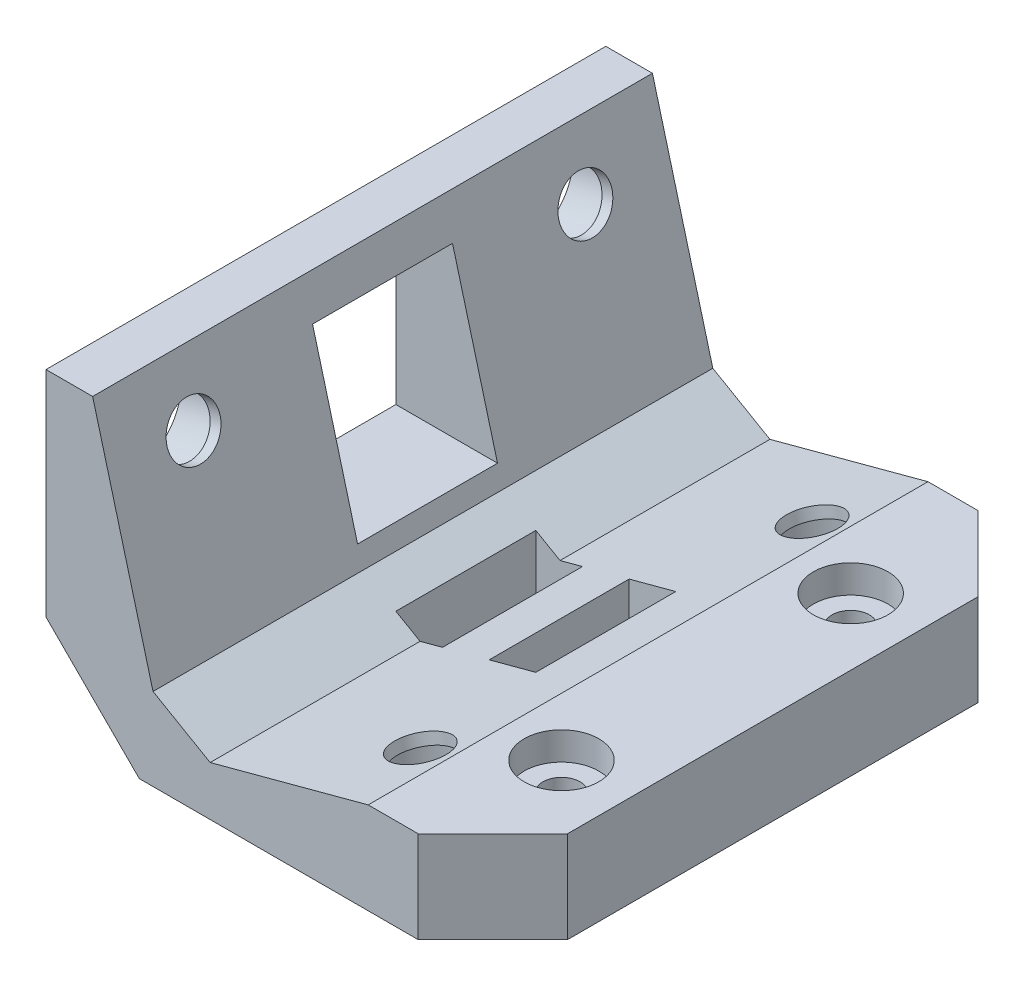
from build123d import *

# Parameters (mm, degrees)
BOSS_EXTRU_1_DEPTH       = 60
ESQUISSE2_R              = 2.85
ENL_V_MAT_EXTRU_1_DEPTH  = 30
ESQUISSE3_R              = 2.85
ENL_V_MAT_EXTRU_2_DEPTH  = 1.2
ENL_V_START              = -1.2
ESQUISSE4_R              = 5.5
ENL_V_MAT_EXTRU_3_DEPTH  = 30
CHANFREIN1_SIZE          = 5
CHANFREIN3_SIZE          = 10
ENL_V_MAT_EXTRU_5_REACH  = 83.872
ESQUISSE7_R              = 5.5
CHANFREIN4_SIZE          = 2
CHANFREIN4_SIZE2         = 7.464101615
BOSS_EXTRU_3_DEPTH       = 60
ESQUISSE10_R             = 2
ENL_V_MAT_EXTRU_7_DEPTH  = 60
ESQUISSE11_R             = 4
ENL_V_MAT_EXTRU_8_DEPTH  = 3
CHANFREIN5_SIZE          = 8
ESQUISSE12_W             = 5
ESQUISSE12_H             = 15
ENL_V_MAT_EXTRU_9_DEPTH  = 84.554960758
ESQUISSE13_W             = 15
ESQUISSE13_H             = 18
ENL_V_MAT_EXTRU_10_DEPTH = 84.554960758


with BuildPart() as part:
    # Esquisse1 → Boss.-Extru.1 (new body)
    with BuildSketch(Plane.XY):
        Polygon((0, 0), (44.894653535, 0), (41.742346142, 11.764571353), (12.764571353, 4), (5, 32.977774789), (0, 32.977774789), align=None)
    extrude(amount=BOSS_EXTRU_1_DEPTH)

    # Esquisse2 → Enlèv. mat.-Extru.1 (cut)
    with BuildSketch(Plane(origin=(12.909507207, 3.459092031, 0), x_dir=(0, 0, -1), z_dir=(0.965925826289071, 0.258819045102511, 0))):
        with Locations(Location((-51, 23.559989136, 0), (0, 0, 90))):
            Circle(ESQUISSE2_R)
        with Locations(Location((-9, 23.559989136, 0), (0, 0, 90))):
            Circle(ESQUISSE2_R)
    extrude(amount=-ENL_V_MAT_EXTRU_1_DEPTH, mode=Mode.SUBTRACT)

    # Esquisse3 → Enlèv. mat.-Extru.2 (cut)
    with BuildSketch(Plane(origin=(-0.144935854, 0.540907969, 0), x_dir=(0.96592582628907, 0.2588190451025147, 0), z_dir=(-0.25881904510251463, 0.9659258262890699, 0))):
        with Locations(Location((32.364905312, -9, 0), (0, 0, 180))):
            Circle(ESQUISSE3_R)
        with Locations(Location((32.364905312, -51, 0), (0, 0, 180))):
            Circle(ESQUISSE3_R)
    extrude(amount=-ENL_V_MAT_EXTRU_2_DEPTH, mode=Mode.SUBTRACT)

    # Esquisse4 → Enlèv. mat.-Extru.3 (cut)
    with BuildSketch(Plane(origin=(12.909507207, 3.459092031, 0), x_dir=(0, 0, -1), z_dir=(0.965925826289071, 0.258819045102511, 0)).offset(ENL_V_START)):
        with Locations(Location((-51, 23.559989136, 0), (0, 0, 90))):
            Circle(ESQUISSE4_R)
        with Locations(Location((-9, 23.559989136, 0), (0, 0, 90))):
            Circle(ESQUISSE4_R)
    extrude(amount=-ENL_V_MAT_EXTRU_3_DEPTH, mode=Mode.SUBTRACT)

    # Chanfrein1
    chanfrein1_edges = [part.edges().sort_by_distance(p)[0] for p in [
        (12.764571353, 4, 30),
    ]]
    chamfer(chanfrein1_edges, length=CHANFREIN1_SIZE)

    # Chanfrein3
    chanfrein3_edges = [part.edges().sort_by_distance(p)[0] for p in [
        (0, 0, 30),
    ]]
    chamfer(chanfrein3_edges, length=CHANFREIN3_SIZE)

    # Enlèv. mat.-Extru.5: up to this plane
    enl_v_mat_extru_5_end = Plane(origin=(31.427744907, 7.758450865, 51), z_dir=(-0.2588190451025147, 0.96592582628907, 0))
    # Esquisse7 → Enlèv. mat.-Extru.5 (cut, up to the surface)
    with BuildSketch(Plane.XZ, mode=Mode.PRIVATE) as enl_v_mat_extru_5_sk1:
        with Locations((31.117162053, 51)):
            Circle(ESQUISSE7_R)
    enl_v_mat_extru_5_tool1 = split(extrude(enl_v_mat_extru_5_sk1.sketch, amount=-ENL_V_MAT_EXTRU_5_REACH, mode=Mode.PRIVATE), bisect_by=enl_v_mat_extru_5_end, keep=Keep.BOTH, mode=Mode.PRIVATE)
    add(enl_v_mat_extru_5_tool1.solids().sort_by_distance((31.117162, 0, 51))[0], mode=Mode.SUBTRACT)
    # Esquisse7 → Enlèv. mat.-Extru.5 (cut, up to the surface)
    with BuildSketch(Plane.XZ, mode=Mode.PRIVATE) as enl_v_mat_extru_5_sk2:
        with Locations((31.117162053, 9)):
            Circle(ESQUISSE7_R)
    enl_v_mat_extru_5_tool2 = split(extrude(enl_v_mat_extru_5_sk2.sketch, amount=-ENL_V_MAT_EXTRU_5_REACH, mode=Mode.PRIVATE), bisect_by=enl_v_mat_extru_5_end, keep=Keep.BOTH, mode=Mode.PRIVATE)
    add(enl_v_mat_extru_5_tool2.solids().sort_by_distance((31.117162, 0, 9))[0], mode=Mode.SUBTRACT)

    # Chanfrein4
    chanfrein4_edges = [part.edges().sort_by_distance(p)[0] for p in [
        (41.742346142, 11.764571353, 30),
    ]]
    chanfrein4_side = [part.faces().sort_by_distance(p)[0] for p in [
        (43.318499838, 5.882285677, 30),
    ]]
    chamfer(chanfrein4_edges, length=CHANFREIN4_SIZE, length2=CHANFREIN4_SIZE2, reference=chanfrein4_side[0])

    # Esquisse8 → Boss.-Extru.3 (add)
    with BuildSketch(Plane.XY.offset(60)):
        Polygon((42.259984232, 9.8327197), (47.894653535, 9.8327197), (47.894653535, 0), (44.894653535, 0), align=None)
    extrude(amount=-BOSS_EXTRU_3_DEPTH)

    # Esquisse10 → Enlèv. mat.-Extru.7 (cut)
    with BuildSketch(Plane(origin=(0, 9.8327197, 0), x_dir=(1, 0, 0), z_dir=(0, 1, 0))):
        with Locations(Location((40.75, -14.5, 0), (0, 0, 180))):
            Circle(ESQUISSE10_R)
        with Locations(Location((40.75, -45.5, 0), (0, 0, 180))):
            Circle(ESQUISSE10_R)
    extrude(amount=-ENL_V_MAT_EXTRU_7_DEPTH, mode=Mode.SUBTRACT)

    # Esquisse11 → Enlèv. mat.-Extru.8 (cut)
    with BuildSketch(Plane(origin=(0, 9.8327197, 0), x_dir=(1, 0, 0), z_dir=(0, 1, 0))):
        with Locations(Location((40.75, -14.5, 0), (0, 0, 180))):
            Circle(ESQUISSE11_R)
        with Locations(Location((40.75, -45.5, 0), (0, 0, 180))):
            Circle(ESQUISSE11_R)
    extrude(amount=-ENL_V_MAT_EXTRU_8_DEPTH, mode=Mode.SUBTRACT)

    # Chanfrein5
    chanfrein5_edges = [part.edges().sort_by_distance(p)[0] for p in [
        (47.894653535, 4.91635985, 0),
        (47.894653535, 4.91635985, 60),
    ]]
    chamfer(chanfrein5_edges, length=CHANFREIN5_SIZE)

    # Esquisse12 → Enlèv. mat.-Extru.9 (cut, through all)
    with BuildSketch(Plane.XZ):
        with Locations((17.5, 30)):
            Rectangle(ESQUISSE12_W, ESQUISSE12_H)
        with Locations((27.5, 30)):
            Rectangle(ESQUISSE12_W, ESQUISSE12_H)
    extrude(amount=-ENL_V_MAT_EXTRU_9_DEPTH, mode=Mode.SUBTRACT)

    # Esquisse13 → Enlèv. mat.-Extru.10 (cut, through all)
    with BuildSketch(Plane.ZY):
        with Locations((30, 19.977774789)):
            Rectangle(ESQUISSE13_W, ESQUISSE13_H)
    extrude(amount=-ENL_V_MAT_EXTRU_10_DEPTH, mode=Mode.SUBTRACT)


solid = part.part
